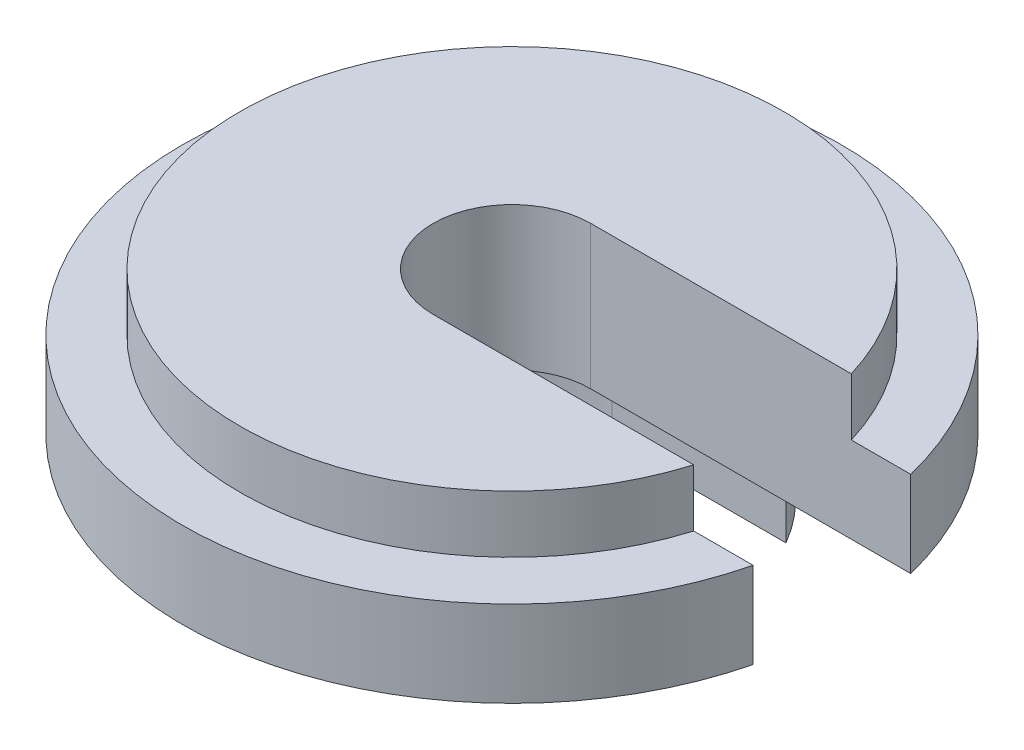
from build123d import *

# Parameters (mm, degrees)
CUT_EXTRUDE1_START = -2
CUT_EXTRUDE1_DEPTH = 2
CUT_EXTRUDE2_DEPTH = 11


with BuildPart() as part:
    # Sketch1 → Revolve1 (revolve)
    with BuildSketch(Plane.XY, mode=Mode.PRIVATE) as revolve1_sk:
        Polygon((0, 0), (7, 0), (7, 2), (11.5, 2), (11.5, 5), (9.5, 5), (9.5, 7), (0, 7), align=None)
    revolve(revolve1_sk.sketch.rotate(Axis((0, 7, 0), (0, -1, 0)), 90), axis=Axis((0, 7, 0), (0, -1, 0)))

    # Sketch3 → Cut-Extrude1 (cut)
    with BuildSketch(Plane.XZ.offset(CUT_EXTRUDE1_START)):
        with BuildLine():
            Line((0, 3.5), (6.062177826, 3.5))
            ThreePointArc((6.062177826, 3.5), (7, 0), (6.062177826, -3.5))
            Line((6.062177826, -3.5), (0, -3.5))
            ThreePointArc((0, -3.5), (-3.5, 0), (0, 3.5))
        make_face()
    extrude(amount=CUT_EXTRUDE1_DEPTH, mode=Mode.SUBTRACT)

    # Sketch4 → Cut-Extrude2 (cut)
    with BuildSketch(Plane(origin=(0, 7, 0), x_dir=(1, 0, 0), z_dir=(0, 1, 0))):
        with BuildLine():
            Line((0, 2.75), (11.166355717, 2.75))
            ThreePointArc((11.166355717, 2.75), (11.5, 0), (11.166355717, -2.75))
            Line((11.166355717, -2.75), (0, -2.75))
            ThreePointArc((0, -2.75), (-2.75, 0), (0, 2.75))
        make_face()
    extrude(amount=-CUT_EXTRUDE2_DEPTH, mode=Mode.SUBTRACT)


solid = part.part
